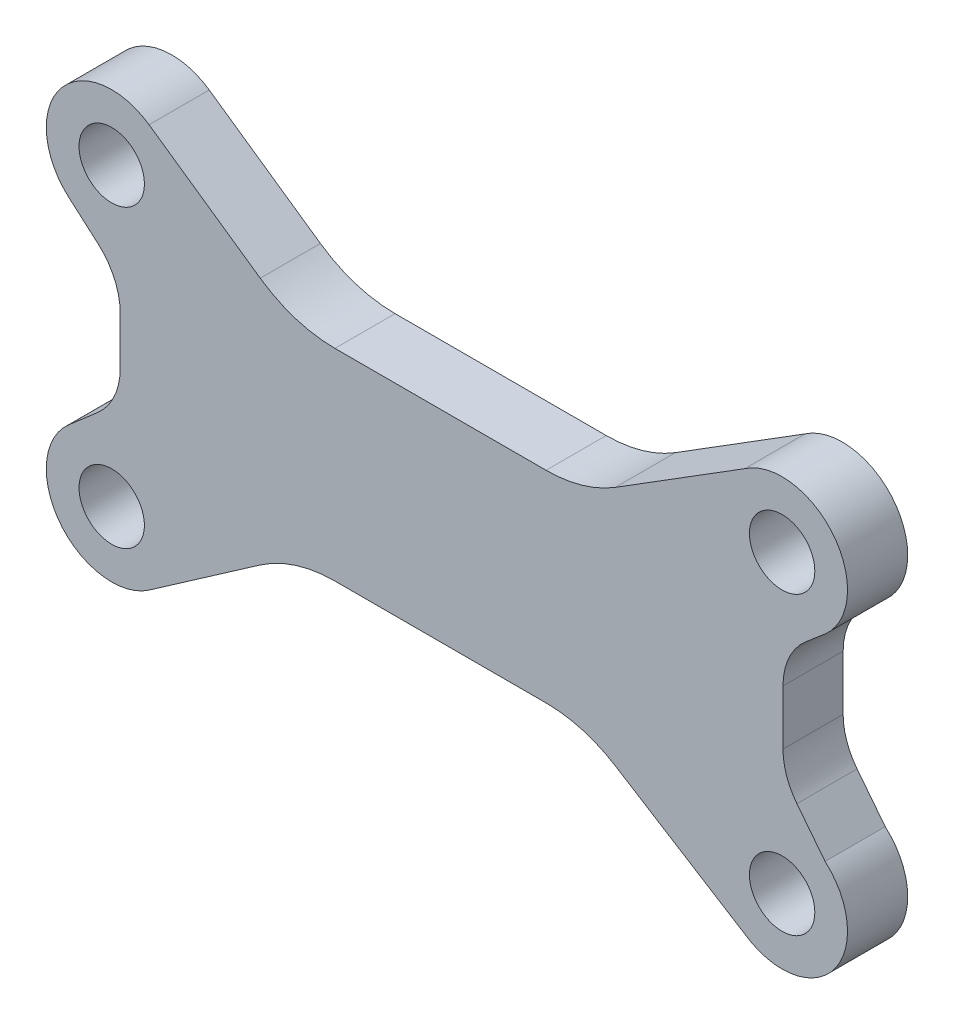
from build123d import *

# Parameters (mm, degrees)
SKETCH1_R           = 3.175
BOSS_EXTRUDE1_DEPTH = 5.842
FILLET1_R           = 6.35
FILLET2_R           = 12.7


with BuildPart() as part:
    # Sketch1 → Boss-Extrude1 (new body)
    with BuildSketch(Plane.XY):
        with BuildLine():
            Line((-22.994485403, 20.272024726), (-17.997254848, 15.918288597))
            Line((-17.997254848, 15.918288597), (-17.997254848, 5.482991472))
            Line((-17.997254848, 5.482991472), (-22.994485403, 1.145618131))
            ThreePointArc((-22.994485403, 1.145618131), (-24.602923257, -1.012071311), (-25.173214286, -3.642178571))
            ThreePointArc((-25.173214286, -3.642178571), (-21.763981419, -9.270178986), (-15.197028879, -8.854978145))
            Line((-15.197028879, -8.854978145), (-1.135121582, 0.926921642))
            Line((-1.135121582, 0.926921642), (26.988693011, 0.926921642))
            Line((26.988693011, 0.926921642), (42.638100307, -8.854978145))
            ThreePointArc((42.638100307, -8.854978145), (49.205052848, -9.270178986), (52.614285714, -3.642178571))
            ThreePointArc((52.614285714, -3.642178571), (52.043994686, -1.012071311), (50.435556832, 1.145618131))
            Line((50.435556832, 1.145618131), (46.348568334, 6.363266694))
            Line((46.348568334, 6.363266694), (46.348568334, 16.798563819))
            Line((46.348568334, 16.798563819), (50.435556832, 20.272024726))
            ThreePointArc((50.435556832, 20.272024726), (51.272005862, 28.964336626), (42.638100307, 30.272621002))
            Line((42.638100307, 30.272621002), (26.988693011, 20.490721215))
            Line((26.988693011, 20.490721215), (-1.135121582, 20.490721215))
            Line((-1.135121582, 20.490721215), (-15.197028879, 30.272621002))
            ThreePointArc((-15.197028879, 30.272621002), (-23.830934433, 28.964336626), (-22.994485403, 20.272024726))
        make_face()
        with Locations((-18.823214286, -3.642178571)):
            Circle(SKETCH1_R, mode=Mode.SUBTRACT)
        with Locations((46.264285714, -3.642178571)):
            Circle(SKETCH1_R, mode=Mode.SUBTRACT)
        with Locations((-18.823214286, 25.059821429)):
            Circle(SKETCH1_R, mode=Mode.SUBTRACT)
        with Locations((46.264285714, 25.059821429)):
            Circle(SKETCH1_R, mode=Mode.SUBTRACT)
    extrude(amount=BOSS_EXTRUDE1_DEPTH)

    # Fillet1
    fillet1_edges = [part.edges().sort_by_distance(p)[0] for p in [
        (-17.997254848, 5.482991472, 2.921),
        (-17.997254848, 15.918288597, 2.921),
        (46.348568334, 16.798563819, 2.921),
        (46.348568334, 6.363266694, 2.921),
    ]]
    fillet(fillet1_edges, radius=FILLET1_R)

    # Fillet2
    fillet2_edges = [part.edges().sort_by_distance(p)[0] for p in [
        (26.988693011, 0.926921642, 2.921),
        (-1.135121582, 0.926921642, 2.921),
        (-1.135121582, 20.490721215, 2.921),
        (26.988693011, 20.490721215, 2.921),
    ]]
    fillet(fillet2_edges, radius=FILLET2_R)


solid = part.part
